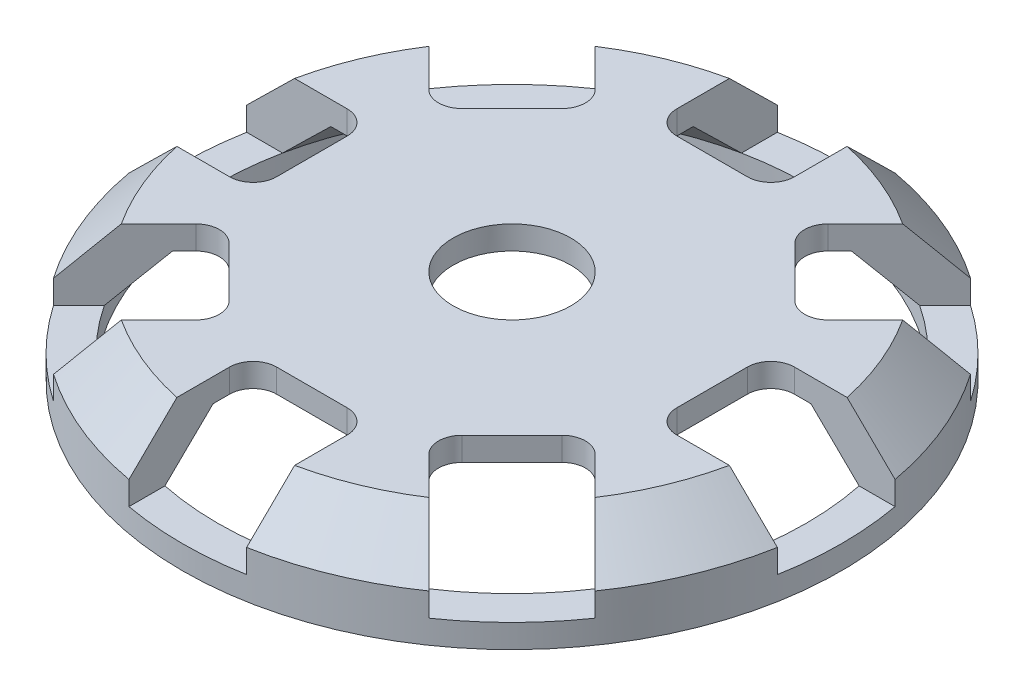
from build123d import *

# Parameters (mm, degrees)
SKETCH1_R           = 14
BOSS_EXTRUDE1_DEPTH = 4
SKETCH2_R           = 12.5
CUT_EXTRUDE1_DEPTH  = 3
CHAMFER2_SIZE       = 2
CUT_EXTRUDE2_START  = -3
CUT_EXTRUDE2_DEPTH  = 3
FILLET2_R           = 1
SKETCH4_R           = 2.5
CUT_EXTRUDE3_DEPTH  = 3


with BuildPart() as part:
    # Sketch1 → Boss-Extrude1 (new body)
    with BuildSketch(Plane(origin=(0, 0, 0), x_dir=(1, 0, 0), z_dir=(0, 1, 0))):
        Circle(SKETCH1_R)
    extrude(amount=BOSS_EXTRUDE1_DEPTH)

    # Sketch2 → Cut-Extrude1 (cut)
    with BuildSketch(Plane.XZ):
        Circle(SKETCH2_R)
    extrude(amount=-CUT_EXTRUDE1_DEPTH, mode=Mode.SUBTRACT)

    # Chamfer2
    chamfer2_edges = [part.edges().sort_by_distance(p)[0] for p in [
        (-12.5, 3, 0),
        (-14, 4, 0),
    ]]
    chamfer(chamfer2_edges, length=CHAMFER2_SIZE)

    # Sketch3 → Cut-Extrude2 (cut)
    with BuildSketch(Plane(origin=(0, 4, 0), x_dir=(1, 0, 0), z_dir=(0, 1, 0)).offset(CUT_EXTRUDE2_START)):
        with BuildLine():
            ThreePointArc((-13.774977314, 2.5), (-14, 0), (-13.774977314, -2.5))
            Line((-13.774977314, -2.5), (-8.5, -2.5))
            Line((-8.5, -2.5), (-8.5, 2.5))
            Line((-8.5, 2.5), (-13.774977314, 2.5))
        make_face()
        with BuildLine():
            Line((-4.242640687, 7.778174593), (-7.972612916, 11.508146822))
            ThreePointArc((-7.972612916, 11.508146822), (-9.899494937, 9.899494937), (-11.508146822, 7.972612916))
            Line((-11.508146822, 7.972612916), (-7.778174593, 4.242640687))
            Line((-7.778174593, 4.242640687), (-4.242640687, 7.778174593))
        make_face()
        with BuildLine():
            Line((-7.972612916, -11.508146822), (-4.242640687, -7.778174593))
            Line((-4.242640687, -7.778174593), (-7.778174593, -4.242640687))
            Line((-7.778174593, -4.242640687), (-11.508146822, -7.972612916))
            ThreePointArc((-11.508146822, -7.972612916), (-9.899494937, -9.899494937), (-7.972612916, -11.508146822))
        make_face()
        with BuildLine():
            Line((2.5, 8.5), (2.5, 13.774977314))
            ThreePointArc((2.5, 13.774977314), (0, 14), (-2.5, 13.774977314))
            Line((-2.5, 13.774977314), (-2.5, 8.5))
            Line((-2.5, 8.5), (2.5, 8.5))
        make_face()
        with BuildLine():
            Line((2.5, -13.774977314), (2.5, -8.5))
            Line((2.5, -8.5), (-2.5, -8.5))
            Line((-2.5, -8.5), (-2.5, -13.774977314))
            ThreePointArc((-2.5, -13.774977314), (0, -14), (2.5, -13.774977314))
        make_face()
        with BuildLine():
            Line((7.778174593, 4.242640687), (11.508146822, 7.972612916))
            ThreePointArc((11.508146822, 7.972612916), (9.899494937, 9.899494937), (7.972612916, 11.508146822))
            Line((7.972612916, 11.508146822), (4.242640687, 7.778174593))
            Line((4.242640687, 7.778174593), (7.778174593, 4.242640687))
        make_face()
        with BuildLine():
            Line((11.508146822, -7.972612916), (7.778174593, -4.242640687))
            Line((7.778174593, -4.242640687), (4.242640687, -7.778174593))
            Line((4.242640687, -7.778174593), (7.972612916, -11.508146822))
            ThreePointArc((7.972612916, -11.508146822), (9.899494937, -9.899494937), (11.508146822, -7.972612916))
        make_face()
        with BuildLine():
            Line((8.5, -2.5), (13.774977314, -2.5))
            ThreePointArc((13.774977314, -2.5), (14, 0), (13.774977314, 2.5))
            Line((13.774977314, 2.5), (8.5, 2.5))
            Line((8.5, 2.5), (8.5, -2.5))
        make_face()
    extrude(amount=CUT_EXTRUDE2_DEPTH, mode=Mode.SUBTRACT)

    # Fillet2
    fillet2_edges = [part.edges().sort_by_distance(p)[0] for p in [
        (8.5, 3.5, 2.5),
        (4.242640687, 3.5, 7.778174593),
        (8.5, 3.5, -2.5),
        (7.778174593, 3.5, -4.242640687),
        (4.242640687, 3.5, -7.778174593),
        (-2.5, 3.5, -8.5),
        (2.5, 3.5, -8.5),
        (-4.242640687, 3.5, -7.778174593),
        (-7.778174593, 3.5, -4.242640687),
        (-8.5, 3.5, 2.5),
        (-8.5, 3.5, -2.5),
        (-4.242640687, 3.5, 7.778174593),
        (2.5, 3.5, 8.5),
        (7.778174593, 3.5, 4.242640687),
        (-7.778174593, 3.5, 4.242640687),
        (-2.5, 3.5, 8.5),
    ]]
    fillet(fillet2_edges, radius=FILLET2_R)

    # Sketch4 → Cut-Extrude3 (cut)
    with BuildSketch(Plane(origin=(0, 4, 0), x_dir=(1, 0, 0), z_dir=(0, 1, 0))):
        Circle(SKETCH4_R)
    extrude(amount=-CUT_EXTRUDE3_DEPTH, mode=Mode.SUBTRACT)


solid = part.part
